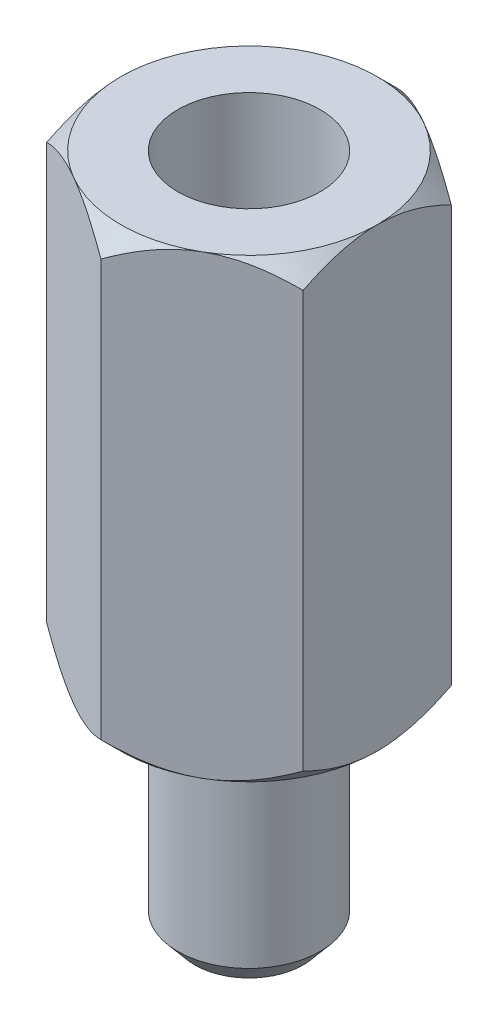
from build123d import *

# Parameters (mm, degrees)
SKETCH1_R           = 1.25
BOSS_EXTRUDE1_DEPTH = 3.9
BOSS_EXTRUDE2_DEPTH = 8
CUT_EXTRUDE1_START  = -4.8
SKETCH3_R           = 1.25
CUT_EXTRUDE1_DEPTH  = 4.8
SKETCH4_OUTSIDE_W   = 36.022
SKETCH4_OUTSIDE_H   = 36.718
SKETCH4_OUTSIDE_R   = 2.25
CUT_EXTRUDE3_DEPTH  = 13.386383653
CUT_EXTRUDE3_DRAFT  = -45
SKETCH6_OUTSIDE_W   = 28.662
SKETCH6_OUTSIDE_H   = 29.358
SKETCH6_OUTSIDE_R   = 2.25
CUT_EXTRUDE4_DEPTH  = 9.707037384
CUT_EXTRUDE4_DRAFT  = -45
CHAMFER1_SIZE       = 0.3
CHAMFER1_SIZE2      = 0.357526078


with BuildPart() as part:
    # Sketch1 → Boss-Extrude1 (new body)
    with BuildSketch(Plane(origin=(0, 0, 0), x_dir=(1, 0, 0), z_dir=(0, 1, 0))):
        with Locations(Location((0, 0, 0), (0, 0, 270))):
            Circle(SKETCH1_R)
    extrude(amount=BOSS_EXTRUDE1_DEPTH)

    # Sketch2 → Boss-Extrude2 (add)
    with BuildSketch(Plane(origin=(0, 3.9, 0), x_dir=(1, 0, 0), z_dir=(0, 1, 0))):
        Polygon((0, 2.598076211), (-2.25, 1.299038106), (-2.25, -1.299038106), (0, -2.598076211), (2.25, -1.299038106), (2.25, 1.299038106), align=None)
    extrude(amount=BOSS_EXTRUDE2_DEPTH)

    # Sketch3 → Cut-Extrude1 (cut)
    with BuildSketch(Plane(origin=(0, 11.9, 0), x_dir=(1, 0, 0), z_dir=(0, 1, 0)).offset(CUT_EXTRUDE1_START)):
        with Locations(Location((0, 0, 0), (0, 0, 270))):
            Circle(SKETCH3_R)
    extrude(amount=CUT_EXTRUDE1_DEPTH, mode=Mode.SUBTRACT)


with BuildPart() as cut_extrude3_tool:
    # Sketch4 outside → Cut-Extrude3 (with draft: the straight prism first)
    with BuildSketch(Plane(origin=(0, 11.9, 0), x_dir=(1, 0, 0), z_dir=(0, 1, 0))):
        Rectangle(SKETCH4_OUTSIDE_W, SKETCH4_OUTSIDE_H)
        Circle(SKETCH4_OUTSIDE_R, mode=Mode.SUBTRACT)
    extrude(amount=-CUT_EXTRUDE3_DEPTH)
    # Cut-Extrude3: the draft: its side faces are tilted about the plane it starts from
    cut_extrude3_sides = [cut_extrude3_tool.faces().sort_by_distance(p)[0] for p in [
        (0, 5.206808173, 18.359),
        (18.011, 5.206808173, 0),
        (0, 5.206808173, -18.359),
        (-18.011, 5.206808173, 0),
        (-2.25, 5.206808173, 0),
    ]]
    draft(cut_extrude3_sides, Plane(origin=(0, 11.9, 0), x_dir=(1, 0, 0), z_dir=(0, 1, 0)), CUT_EXTRUDE3_DRAFT)


with BuildPart() as part_1:
    add(part.part)

    # Cut-Extrude3: cut by cut_extrude3_tool
    add(cut_extrude3_tool.part, mode=Mode.SUBTRACT)


with BuildPart() as cut_extrude4_tool:
    # Sketch6 outside → Cut-Extrude4 (with draft: the straight prism first)
    with BuildSketch(Plane.XZ.offset(-3.9)):
        Rectangle(SKETCH6_OUTSIDE_W, SKETCH6_OUTSIDE_H)
        Circle(SKETCH6_OUTSIDE_R, mode=Mode.SUBTRACT)
    extrude(amount=-CUT_EXTRUDE4_DEPTH)
    # Cut-Extrude4: the draft: its side faces are tilted about the plane it starts from
    cut_extrude4_sides = [cut_extrude4_tool.faces().sort_by_distance(p)[0] for p in [
        (0, 8.753518692, -14.679),
        (14.331, 8.753518692, 0),
        (0, 8.753518692, 14.679),
        (-14.331, 8.753518692, 0),
        (-2.25, 8.753518692, 0),
    ]]
    draft(cut_extrude4_sides, Plane.XZ.offset(-3.9), CUT_EXTRUDE4_DRAFT)


with BuildPart() as part_2:
    add(part_1.part)

    # Cut-Extrude4: cut by cut_extrude4_tool
    add(cut_extrude4_tool.part, mode=Mode.SUBTRACT)

    # Chamfer1
    chamfer1_edges = [part_2.edges().sort_by_distance(p)[0] for p in [
        (0, 0, -1.25),
    ]]
    chamfer1_side = [part_2.faces().sort_by_distance(p)[0] for p in [
        (0, 0, 0),
    ]]
    chamfer(chamfer1_edges, length=CHAMFER1_SIZE, length2=CHAMFER1_SIZE2, reference=chamfer1_side[0])


solid = part_2.part
